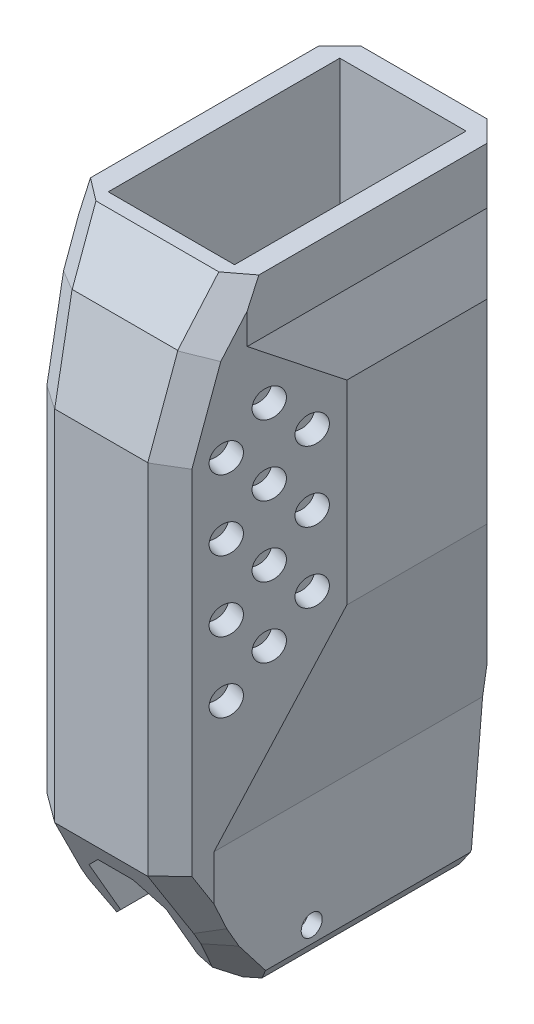
from build123d import *
from OCP.BRepFilletAPI import BRepFilletAPI_MakeChamfer

# Parameters (mm, degrees)
BOSS_EXTRU_1_DEPTH           = 890
ENL_V_MAT_EXTRU_1_DEPTH      = 1079.285676433
ESQUISSE4_W                  = 889.957949445
ESQUISSE4_H                  = 1073.13016773
ENL_V_MAT_EXTRU_2_DEPTH      = 1079.285676433
BOSS_EXTRU_2_DEPTH           = 90
ESQUISSE6_R                  = 15
ENL_V_MAT_EXTRU_3_DEPTH      = 1042.6333328
ENL_V_MAT_EXTRU_4_DEPTH      = 1042.6333328
CHANFREIN4_SIZE              = 30
CHANFREIN4_SIZE2             = 83.306518089
CHANFREIN4_SIZE2_2           = 25.692268859
CHANFREIN4_SIZE2_3           = 26.483089153
CHANFREIN4_SIZE2_4           = 21.006226146
CHANFREIN4_SIZE2_5           = 26.769795857
ESQUISSE8_R                  = 20
ENL_V_MAT_EXTRU_5_DEPTH      = 30
ESQUISSE9_R                  = 15
ENL_V_MAT_EXTRU_6_DEPTH      = 20
CHANFREIN6_SIZE              = 10
CHANFREIN6_SIZE2             = 16.642794824
CHANFREIN6_SIZE2_2           = 72.16324794
CHANFREIN6_SIZE2_3           = 19.009355676
CHANFREIN6_SIZE2_4           = 31.097646332
ENL_V_MAT_EXTRU_7_DEPTH      = 90
ENL_V_MAT_EXTRU_7_DEPTH_BACK = 110
ESQUISSE10_W                 = 110
ESQUISSE10_H                 = 220.72988372
ENL_V_MAT_EXTRU_8_DEPTH      = 100
ENL_V_MAT_EXTRU_8_DEPTH_BACK = 110
ESQUISSE11_W                 = 110
ESQUISSE11_H                 = 218.621274356
CHANFREIN5_SIZE              = 30


with BuildPart() as part:
    # Esquisse2 → Boss.-Extru.1 (new body)
    with BuildSketch(Plane(origin=(0, 0, 0), x_dir=(1, 0, 0), z_dir=(0, 1, 0))):
        Polygon((150, 0), (0, 0), (0, 110), (90, 110), (90, 440), (0, 440), (0, 590), (150, 590), align=None)
    extrude(amount=BOSS_EXTRU_1_DEPTH)

    # Esquisse3 → Enlèv. mat.-Extru.1 (cut, through all)
    with BuildSketch(Plane.XY):
        Polygon((120, 810), (150, 727.575677416), (150, 450), (110, 200), (110, 0), (350.595322466, 0), (350.595322466, 890), (120, 890), align=None)
    extrude(amount=-ENL_V_MAT_EXTRU_1_DEPTH, mode=Mode.SUBTRACT)

    # Esquisse4 → Enlèv. mat.-Extru.2 (cut, through all)
    with BuildSketch(Plane(origin=(0, 0, 0), x_dir=(0, 0, -1), z_dir=(1, 0, 0))):
        with Locations((289.052917552, 410.770848098)):
            Rectangle(ESQUISSE4_W, ESQUISSE4_H)
        Polygon((110, 0), (10, 173.205080757), (10, 683.811978465), (43.811978465, 810), (90, 890), (470, 890), (470, 810), (520, 723.397459622), (520, 298.564064606), (440, 0), align=None, mode=Mode.SUBTRACT)
    extrude(amount=ENL_V_MAT_EXTRU_2_DEPTH, mode=Mode.SUBTRACT)

    # Esquisse5 → Boss.-Extru.2 (add)
    with BuildSketch(Plane.ZY.offset(-90)):
        Polygon((-400, 0), (-440, 80), (-440, 0), align=None)
        Polygon((-110, 0), (-110, 80), (-150, 0), align=None)
    extrude(amount=BOSS_EXTRU_2_DEPTH)

    # Esquisse6 → Enlèv. mat.-Extru.3 (cut, through all)
    with BuildSketch(Plane(origin=(0, 0, 0), x_dir=(0, 0, -1), z_dir=(1, 0, 0))):
        with Locations(Location((200, 40, 0), (0, 0, 270))):
            Circle(ESQUISSE6_R)
    extrude(amount=ENL_V_MAT_EXTRU_3_DEPTH, mode=Mode.SUBTRACT)

    # Esquisse7 → Enlèv. mat.-Extru.4 (cut, through all)
    with BuildSketch(Plane(origin=(0, 0, 0), x_dir=(1, 0, 0), z_dir=(0, 1, 0))):
        Polygon((40, 520), (150, 410), (150, 520), align=None)
        Polygon((150, 210), (96.410161514, 10), (150, 10), align=None)
    extrude(amount=ENL_V_MAT_EXTRU_4_DEPTH, mode=Mode.SUBTRACT)

    # Chanfrein4: one chamfer whose edges measure the first distance from different faces: ONE call of the kernel's chamfer builder (chamfer() names one face for all edges)
    chanfrein4_edges_1 = [part.edges().sort_by_distance(p)[0] for p in [
        (75, 167.942286341, -485),
    ]]
    chanfrein4_side_1 = [part.faces().sort_by_distance(p)[0] for p in [
        (42.782152231, 125.283280391, -473.569553806),
    ]]
    chanfrein4_edges_2 = [part.edges().sort_by_distance(p)[0] for p in [
        (111.658075373, 850, -66.905989232),
    ]]
    chanfrein4_side_2 = [part.faces().sort_by_distance(p)[0] for p in [
        (55.886193741, 850.738925094, -67.332607834),
    ]]
    chanfrein4_edges_3 = [part.edges().sort_by_distance(p)[0] for p in [
        (100.940107676, 746.905989232, -26.905989232),
    ]]
    chanfrein4_side_3 = [part.faces().sort_by_distance(p)[0] for p in [
        (50.503935996, 747.849824405, -27.158889105),
    ]]
    chanfrein4_edges_4 = [part.edges().sort_by_distance(p)[0] for p in [
        (110, 42.679491924, -85.358983849),
    ]]
    chanfrein4_side_4 = [part.faces().sort_by_distance(p)[0] for p in [
        (53.367658015, 84.748635641, -61.070352399),
    ]]
    chanfrein4_edges_5 = [part.edges().sort_by_distance(p)[0] for p in [
        (103.205080757, 129.282032303, -35.358983849),
    ]]
    chanfrein4_side_5 = [part.faces().sort_by_distance(p)[0] for p in [
        (53.367658015, 84.748635641, -61.070352399),
    ]]
    chanfrein4_edges_6 = [part.edges().sort_by_distance(p)[0] for p in [
        (96.410161514, 428.508529611, -10),
    ]]
    chanfrein4_side_6 = [part.faces().sort_by_distance(p)[0] for p in [
        (48.205080757, 428.508529611, -10),
    ]]
    chanfrein4 = BRepFilletAPI_MakeChamfer(part.part.solid().wrapped)
    for e in chanfrein4_edges_1:
        chanfrein4.Add(CHANFREIN4_SIZE, CHANFREIN4_SIZE2, e.wrapped, chanfrein4_side_1[0].wrapped)  # the first distance lies on this face
    for e in chanfrein4_edges_2:
        chanfrein4.Add(CHANFREIN4_SIZE, CHANFREIN4_SIZE2_2, e.wrapped, chanfrein4_side_2[0].wrapped)  # the first distance lies on this face
    for e in chanfrein4_edges_3:
        chanfrein4.Add(CHANFREIN4_SIZE, CHANFREIN4_SIZE2_3, e.wrapped, chanfrein4_side_3[0].wrapped)  # the first distance lies on this face
    for e in chanfrein4_edges_4:
        chanfrein4.Add(CHANFREIN4_SIZE, CHANFREIN4_SIZE2_4, e.wrapped, chanfrein4_side_4[0].wrapped)  # the first distance lies on this face
    for e in chanfrein4_edges_5:
        chanfrein4.Add(CHANFREIN4_SIZE, CHANFREIN4_SIZE2_2, e.wrapped, chanfrein4_side_5[0].wrapped)  # the first distance lies on this face
    for e in chanfrein4_edges_6:
        chanfrein4.Add(CHANFREIN4_SIZE, CHANFREIN4_SIZE2_5, e.wrapped, chanfrein4_side_6[0].wrapped)  # the first distance lies on this face
    add(Compound.cast(chanfrein4.Shape()), mode=Mode.REPLACE)

    # Esquisse8 → Enlèv. mat.-Extru.5 (cut)
    with BuildSketch(Plane(origin=(87.451905284, 0, 23.432667397), x_dir=(0.25881904510251447, 0, -0.96592582628907), z_dir=(0.96592582628907, 0, 0.25881904510251447))):
        with Locations((101.381840061, 681.24036999)):
            Circle(ESQUISSE8_R)
        with Locations((101.381840061, 581.24036999)):
            Circle(ESQUISSE8_R)
        with Locations((101.381840061, 481.24036999)):
            Circle(ESQUISSE8_R)
        with Locations((101.381840061, 381.24036999)):
            Circle(ESQUISSE8_R)
        with Locations((151.381840061, 631.24036999)):
            Circle(ESQUISSE8_R)
        with Locations((151.381840061, 531.24036999)):
            Circle(ESQUISSE8_R)
        with Locations((151.381840061, 431.24036999)):
            Circle(ESQUISSE8_R)
        with Locations((201.381840061, 481.24036999)):
            Circle(ESQUISSE8_R)
        with Locations((201.381840061, 581.24036999)):
            Circle(ESQUISSE8_R)
        with Locations((201.381840061, 681.24036999)):
            Circle(ESQUISSE8_R)
        with Locations((151.381840061, 731.24036999)):
            Circle(ESQUISSE8_R)
    extrude(amount=-ENL_V_MAT_EXTRU_5_DEPTH, mode=Mode.SUBTRACT)

    # Esquisse9 → Enlèv. mat.-Extru.6 (cut)
    with BuildSketch(Plane(origin=(280, 0, -280), x_dir=(-0.7071067811865517, 0, -0.7071067811865435), z_dir=(0.7071067811865435, 0, -0.7071067811865517))):
        with Locations((262.000876719, 442.261411778)):
            Circle(ESQUISSE9_R)
        with Locations((286.80532912, 507.719330635)):
            Circle(ESQUISSE9_R)
        with Locations((311.60978152, 573.177249492)):
            Circle(ESQUISSE9_R)
        with Locations((221.347410263, 532.523783036)):
            Circle(ESQUISSE9_R)
        with Locations((201.020677034, 577.654968665)):
            Circle(ESQUISSE9_R)
        with Locations((241.674143491, 487.392597407)):
            Circle(ESQUISSE9_R)
        with Locations((266.478595892, 552.850516264)):
            Circle(ESQUISSE9_R)
        with Locations((291.283048292, 618.308435121)):
            Circle(ESQUISSE9_R)
        with Locations((246.151862663, 597.981701893)):
            Circle(ESQUISSE9_R)
        with Locations((270.956315064, 663.43962075)):
            Circle(ESQUISSE9_R)
        with Locations((225.825129435, 643.112887522)):
            Circle(ESQUISSE9_R)
        with Locations((250.629581835, 708.570806379)):
            Circle(ESQUISSE9_R)
    extrude(amount=-ENL_V_MAT_EXTRU_6_DEPTH, mode=Mode.SUBTRACT)

    # Chanfrein6: one chamfer whose edges measure the first distance from different faces: ONE call of the kernel's chamfer builder (chamfer() names one face for all edges)
    chanfrein6_edges_1 = [part.edges().sort_by_distance(p)[0] for p in [
        (110, 0, -280.093920843),
    ]]
    chanfrein6_side_1 = [part.faces().sort_by_distance(p)[0] for p in [
        (106.521494574, 0, -280.093920843),
    ]]
    chanfrein6_edges_2 = [part.edges().sort_by_distance(p)[0] for p in [
        (95, 0, -122.12795032),
    ]]
    chanfrein6_side_2 = [part.faces().sort_by_distance(p)[0] for p in [
        (106.521494574, 0, -280.093920843),
    ]]
    chanfrein6_edges_3 = [part.edges().sort_by_distance(p)[0] for p in [
        (99.505738415, 0, -432.965970523),
    ]]
    chanfrein6_side_3 = [part.faces().sort_by_distance(p)[0] for p in [
        (106.521494574, 0, -280.093920843),
    ]]
    chanfrein6_edges_4 = [part.edges().sort_by_distance(p)[0] for p in [
        (44.505738415, 0, -440),
    ]]
    chanfrein6_side_4 = [part.faces().sort_by_distance(p)[0] for p in [
        (106.521494574, 0, -280.093920843),
    ]]
    chanfrein6 = BRepFilletAPI_MakeChamfer(part.part.solid().wrapped)
    for e in chanfrein6_edges_1:
        chanfrein6.Add(CHANFREIN6_SIZE, CHANFREIN6_SIZE2, e.wrapped, chanfrein6_side_1[0].wrapped)  # the first distance lies on this face
    for e in chanfrein6_edges_2:
        chanfrein6.Add(CHANFREIN6_SIZE, CHANFREIN6_SIZE2_2, e.wrapped, chanfrein6_side_2[0].wrapped)  # the first distance lies on this face
    for e in chanfrein6_edges_3:
        chanfrein6.Add(CHANFREIN6_SIZE, CHANFREIN6_SIZE2_3, e.wrapped, chanfrein6_side_3[0].wrapped)  # the first distance lies on this face
    for e in chanfrein6_edges_4:
        chanfrein6.Add(CHANFREIN6_SIZE, CHANFREIN6_SIZE2_4, e.wrapped, chanfrein6_side_4[0].wrapped)  # the first distance lies on this face
    add(Compound.cast(chanfrein6.Shape()), mode=Mode.REPLACE)

    # Symétrie1: part across plane


with BuildPart() as part_1:
    add(part.part)
    add(part.part.mirror(Plane(origin=(0, 890, -440), x_dir=(0, 0, 1), z_dir=(1, 0, 0))))

    # Esquisse10 → Enlèv. mat.-Extru.7 (cut, two sides: drawn at the far end of the back side and taken through both)
    with BuildSketch(Plane(origin=(0, 0, -110), x_dir=(-1, 0, 0), z_dir=(0, 0, -1)).offset(-ENL_V_MAT_EXTRU_7_DEPTH_BACK)):
        with Locations((0, 27.840138897)):
            Rectangle(ESQUISSE10_W, ESQUISSE10_H)
    extrude(amount=ENL_V_MAT_EXTRU_7_DEPTH + ENL_V_MAT_EXTRU_7_DEPTH_BACK, mode=Mode.SUBTRACT)

    # Esquisse11 → Enlèv. mat.-Extru.8 (cut, two sides: drawn at the far end of the back side and taken through both)
    with BuildSketch(Plane.XY.offset(-440).offset(-ENL_V_MAT_EXTRU_8_DEPTH_BACK)):
        with Locations((0, 90.689362822)):
            Rectangle(ESQUISSE11_W, ESQUISSE11_H)
    extrude(amount=ENL_V_MAT_EXTRU_8_DEPTH + ENL_V_MAT_EXTRU_8_DEPTH_BACK, mode=Mode.SUBTRACT)

    # Chanfrein5
    chanfrein5_edges = [part_1.edges().sort_by_distance(p)[0] for p in [
        (-55, 138.205080757, -70.103629711),
        (-55, 0, -130),
        (55, 0, -130),
        (55, 138.205080757, -70.103629711),
        (55, 0, -415),
        (55, 200, -460.233486984),
        (-55, 200, -460.233486984),
        (-55, 0, -415),
    ]]
    chamfer(chanfrein5_edges, length=CHANFREIN5_SIZE)


solid = part_1.part
